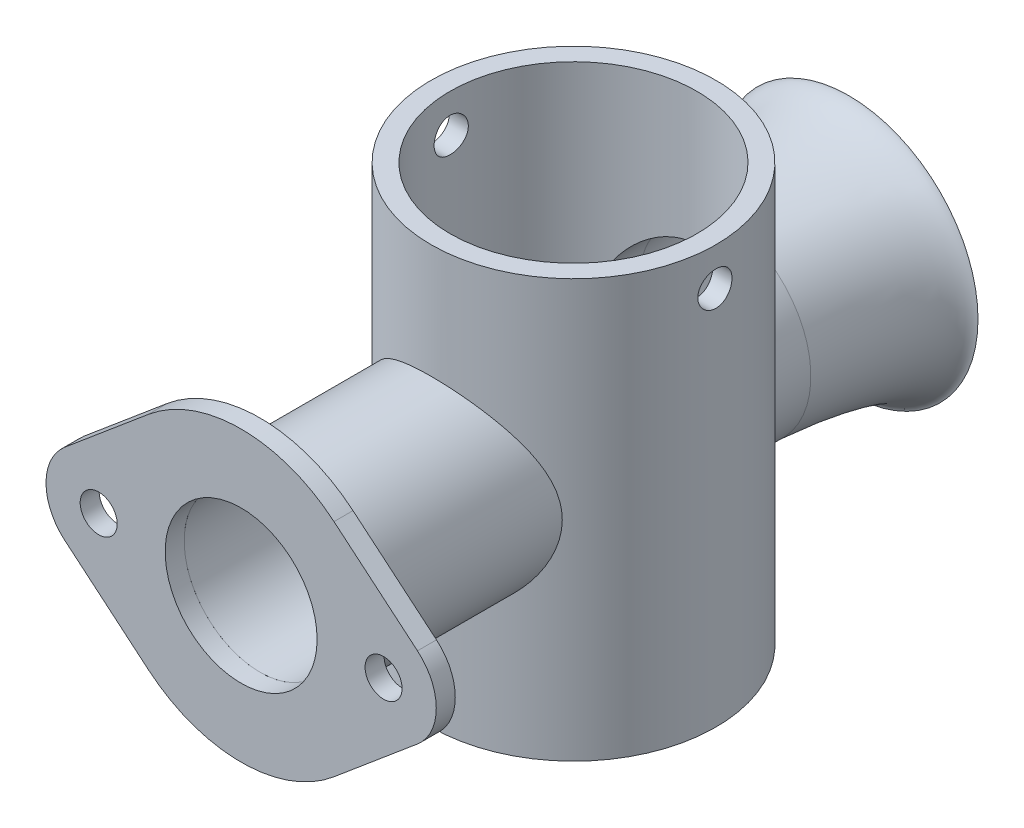
from build123d import *

# Parameters (mm, degrees)
SKETCH1_R                = 7.5
SKETCH1_R_2              = 6.5
BOSS_EXTRUDE1_DEPTH      = 22
BOSS_EXTRUDE2_START      = 17.5
SKETCH2_R                = 4
SKETCH2_R_2              = 0.975
BOSS_EXTRUDE2_DEPTH      = 1
BOSS_EXTRUDE3_DEPTH      = 16.5
BOSS_EXTRUDE3_DEPTH_BACK = 7.5
SKETCH3_R                = 5
SKETCH9_R                = 4
CUT_EXTRUDE1_DEPTH       = 35.85076225
SKETCH11_R               = 6.5
BOSS_EXTRUDE5_DEPTH      = 22
SKETCH12_R               = 6.5
CUT_EXTRUDE2_DEPTH       = 20
SKETCH13_R               = 1.5
CUT_EXTRUDE3_DEPTH       = 30.930346296
CUT_EXTRUDE4_DEPTH       = 30.930346296
CUT_EXTRUDE4_DEPTH_BACK  = 30.930346296
SKETCH14_R               = 0.9


with BuildPart() as part:
    # Sketch1 → Boss-Extrude1 (new body)
    with BuildSketch(Plane(origin=(0, 0, 0), x_dir=(1, 0, 0), z_dir=(0, 1, 0))):
        with Locations(Location((0, 0, 0), (0, 0, 270))):
            Circle(SKETCH1_R)
        with Locations(Location((0, 0, 0), (0, 0, 270))):
            Circle(SKETCH1_R_2, mode=Mode.SUBTRACT)
    extrude(amount=BOSS_EXTRUDE1_DEPTH)



with BuildPart() as body_2:
    # Sketch2 → Boss-Extrude2 (new body)
    with BuildSketch(Plane.XY.offset(BOSS_EXTRUDE2_START)):
        with BuildLine():
            Line((-9.28525, 13.124501692), (-4.889333333, 16.818455083))
            ThreePointArc((-4.889333333, 16.818455083), (0, 18.6), (4.889333333, 16.818455083))
            Line((4.889333333, 16.818455083), (9.28525, 13.124501692))
            ThreePointArc((9.28525, 13.124501692), (10.275, 11), (9.28525, 8.875498308))
            Line((9.28525, 8.875498308), (4.889333333, 5.181544917))
            ThreePointArc((4.889333333, 5.181544917), (0, 3.4), (-4.889333333, 5.181544917))
            Line((-4.889333333, 5.181544917), (-9.28525, 8.875498308))
            ThreePointArc((-9.28525, 8.875498308), (-10.275, 11), (-9.28525, 13.124501692))
        make_face()
        with Locations((0, 11)):
            Circle(SKETCH2_R, mode=Mode.SUBTRACT)
        with Locations((-7.5, 11)):
            Circle(SKETCH2_R_2, mode=Mode.SUBTRACT)
        with Locations((7.5, 11)):
            Circle(SKETCH2_R_2, mode=Mode.SUBTRACT)
    extrude(amount=-BOSS_EXTRUDE2_DEPTH)


with BuildPart() as body_3:
    # Sketch3 → Boss-Extrude3 (new, two sides: drawn at the far end of the back side and taken through both)
    with BuildSketch(Plane.XY.offset(-BOSS_EXTRUDE3_DEPTH_BACK)):
        with Locations((0, 11)):
            Circle(SKETCH3_R)
    extrude(amount=BOSS_EXTRUDE3_DEPTH + BOSS_EXTRUDE3_DEPTH_BACK)


with BuildPart() as part_1:
    add(part.part)

    add(body_3.part)  # Revolve1 merges body 3
    # Sketch8 → Revolve1 (revolve)
    with BuildSketch(Plane(origin=(0, 0, 0), x_dir=(0, 0, -1), z_dir=(1, 0, 0))):
        with BuildLine():
            Line((14.5, 17.799305288), (14.5, 16.799305288))
            add(Edge.make_bspline(
                [(7.5, 15), (10.027506541, 15.070845427), (14.326887273, 16.097322761), (14.5, 16.799305288)],
                knots=[0, 0, 0, 0, 1, 1, 1, 1], degree=3))
            Line((7.5, 15), (7.5, 16))
            add(Edge.make_bspline(
                [(7.5, 16), (10.027523271, 16.145992602), (14.116044918, 16.720481547), (14.5, 17.799305288)],
                knots=[0, 0, 0, 0, 1, 1, 1, 1], degree=3))
        make_face()
    revolve(axis=Axis((0, 11, -7.5), (0, 0, -1)))

    # Sketch9 → Cut-Extrude1 (cut, through all)
    with BuildSketch(Plane(origin=(0, 0, -7.5), x_dir=(-1, 0, 0), z_dir=(0, 0, -1))):
        with Locations(Location((0, 11, 0), (0, 0, 180))):
            Circle(SKETCH9_R)
    extrude(amount=-CUT_EXTRUDE1_DEPTH, mode=Mode.SUBTRACT)

    # Sketch11 → Boss-Extrude5 (add, through all)
    with BuildSketch(Plane(origin=(0, 22, 0), x_dir=(1, 0, 0), z_dir=(0, 1, 0))):
        Circle(SKETCH11_R)
    extrude(amount=-BOSS_EXTRUDE5_DEPTH)

    # Sketch12 → Cut-Extrude2 (cut)
    with BuildSketch(Plane(origin=(0, 22, 0), x_dir=(1, 0, 0), z_dir=(0, 1, 0))):
        with Locations(Location((0, 0, 0), (0, 0, 270))):
            Circle(SKETCH12_R)
    extrude(amount=-CUT_EXTRUDE2_DEPTH, mode=Mode.SUBTRACT)

    # Sketch13 → Cut-Extrude3 (cut, through all)
    with BuildSketch(Plane.XZ):
        with Locations(Location((0, 0, 0), (0, 0, 270))):
            Circle(SKETCH13_R)
    extrude(amount=-CUT_EXTRUDE3_DEPTH, mode=Mode.SUBTRACT)

    # Sketch14 → Cut-Extrude4 (cut, two sides: drawn at the far end of the back side and taken through both)
    with BuildSketch(Plane(origin=(0, 0, 0), x_dir=(0, 0, -1), z_dir=(1, 0, 0)).offset(-CUT_EXTRUDE4_DEPTH_BACK)):
        with Locations((0, 20)):
            Circle(SKETCH14_R)
    extrude(amount=CUT_EXTRUDE4_DEPTH + CUT_EXTRUDE4_DEPTH_BACK, mode=Mode.SUBTRACT)


solid = Compound([body_2.part, part_1.part])
